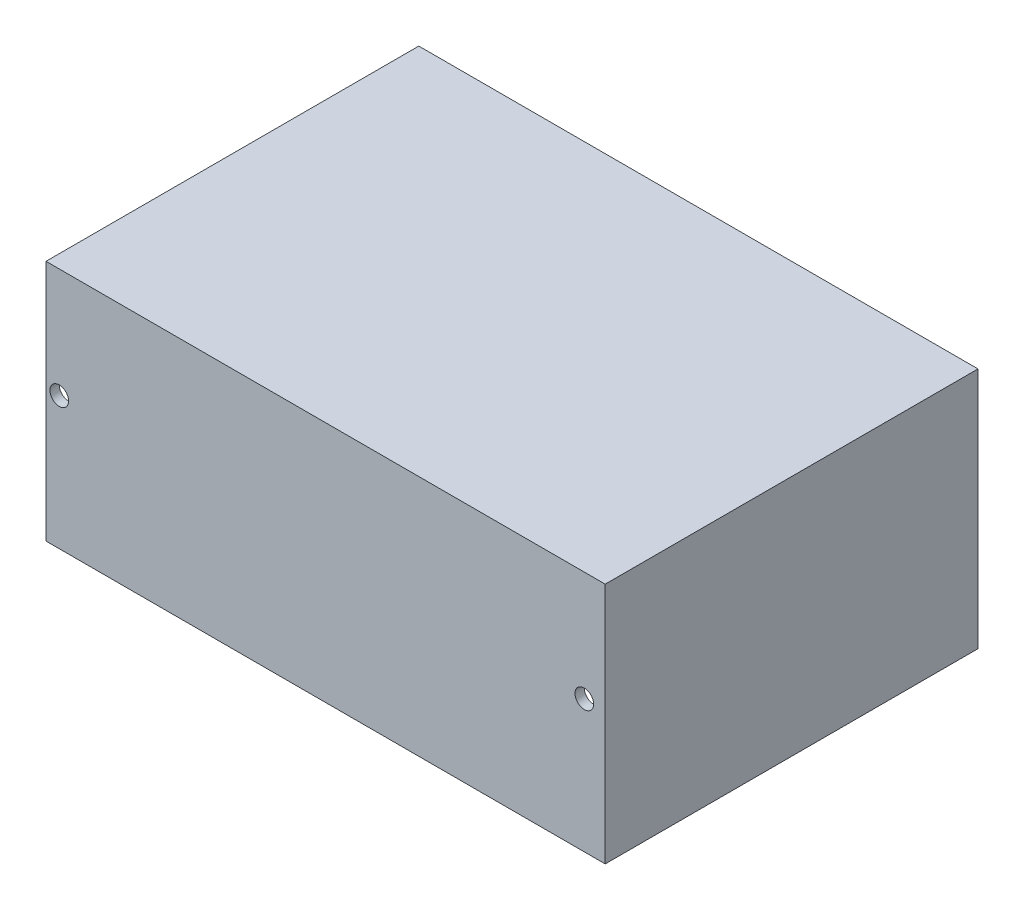
from build123d import *

# Parameters (mm, degrees)
SKETCH3_W           = 200
SKETCH3_H           = 130
BOSS_EXTRUDE1_DEPTH = 300
SHELL2_T            = -5
SKETCH12_R          = 5
CUT_EXTRUDE1_DEPTH  = 300
SKETCH13_R          = 5
CUT_EXTRUDE3_DEPTH  = 300


with BuildPart() as part:
    # Sketch3 → Boss-Extrude1 (new body)
    with BuildSketch(Plane(origin=(0, 0, 0), x_dir=(0, 0, -1), z_dir=(1, 0, 0))):
        with Locations((-81.156140409, 58.885017422)):
            Rectangle(SKETCH3_W, SKETCH3_H)
    extrude(amount=BOSS_EXTRUDE1_DEPTH)

    # Shell2
    shell2_openings = [part.faces().sort_by_distance(p)[0] for p in [
        (0, 58.885017422, 81.156140409),
        (150, -6.114982578, 81.156140409),
    ]]
    offset(amount=SHELL2_T, openings=shell2_openings, kind=Kind.INTERSECTION)

    # Sketch12 → Cut-Extrude1 (cut)
    with BuildSketch(Plane(origin=(0, 0, -18.843859591), x_dir=(-1, 0, 0), z_dir=(0, 0, -1))):
        with Locations((-288.794979597, 65)):
            Circle(SKETCH12_R)
    extrude(amount=-CUT_EXTRUDE1_DEPTH, mode=Mode.SUBTRACT)

    # Sketch13 → Cut-Extrude3 (cut)
    with BuildSketch(Plane.XY.offset(181.156140409)):
        with Locations(Location((7.10538066, 65, 0), (0, 0, 270))):
            Circle(SKETCH13_R)
    extrude(amount=-CUT_EXTRUDE3_DEPTH, mode=Mode.SUBTRACT)


solid = part.part
